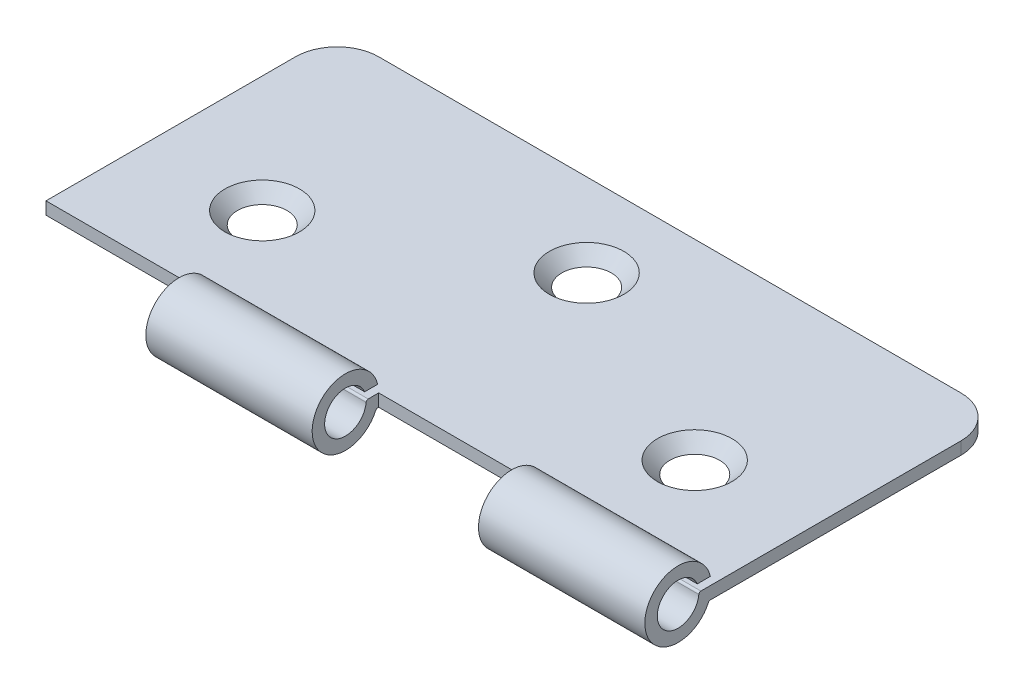
from build123d import *

# Parameters (mm, degrees)
BOSS_EXTRUDE1_DEPTH          = 1.5
BOSS_EXTRUDE2_DEPTH          = 20
LPATTERN1_COUNT              = 2
LPATTERN1_PITCH              = 40
CSK_FOR_M4_SFHCS1_AT_2_COUNT = 2
CSK_FOR_M4_SFHCS1_AT_2_PITCH = 29.068883707
CSK_FOR_M4_SFHCS1_AT_3_COUNT = 2
CSK_FOR_M4_SFHCS1_AT_3_PITCH = 52


with BuildPart() as part:
    # Sketch1 → Boss-Extrude1 (new body)
    with BuildSketch(Plane(origin=(0, 0, 0), x_dir=(1, 0, 0), z_dir=(0, 1, 0))):
        with BuildLine():
            Line((-40, -17.5), (40, -17.5))
            Line((40, -17.5), (40, 12.5))
            ThreePointArc((40, 12.5), (38.535533906, 16.035533906), (35, 17.5))
            Line((35, 17.5), (-35, 17.5))
            ThreePointArc((-35, 17.5), (-38.535533906, 16.035533906), (-40, 12.5))
            Line((-40, 12.5), (-40, -17.5))
        make_face()
    extrude(amount=BOSS_EXTRUDE1_DEPTH)

    # Sketch2 → Boss-Extrude2 (add)
    with BuildSketch(Plane(origin=(40, 0, 0), x_dir=(0, 0, -1), z_dir=(1, 0, 0))):
        with BuildLine():
            Line((-17.616081812, 2.45665015), (-19.190276967, 2.45665015))
            ThreePointArc((-19.190276967, 2.45665015), (-23.971620702, 1.124379043), (-19.010352011, 1.272727273))
            ThreePointArc((-19.010352011, 1.272727273), (-18.929937178, 1.434637236), (-18.761387212, 1.5))
            Line((-18.761387212, 1.5), (-17.5, 1.5))
            Line((-17.5, 1.5), (-17.5, 0))
            Line((-17.5, 0), (-17.627016654, 0))
            ThreePointArc((-17.627016654, 0), (-17.76259819, -0.039957987), (-17.854839204, -0.147058824))
            ThreePointArc((-17.854839204, -0.147058824), (-25.483287925, 1.865263339), (-17.616081812, 2.45665015))
        make_face()
    boss_extrude2 = extrude(amount=-BOSS_EXTRUDE2_DEPTH)

    # LPattern1: Boss-Extrude2 ×2
    with Locations(*[(-i * LPATTERN1_PITCH, 0, 0) for i in range(1, LPATTERN1_COUNT)]):
        add(boss_extrude2)

    # Sketch5 → CSK for M4 SFHCS1 (revolve, cut)
    with BuildSketch(Plane(origin=(-26, 1.5, 5.5), x_dir=(0, 0, 1), z_dir=(1, 0, 0))):
        Polygon((0, 0), (0, 4), (2.25, 4), (2.25, 2.23), (4.48, 0), align=None)
    csk_for_m4_sfhcs1 = revolve(axis=Axis((-26, 7.85, 5.5), (0, -1, 0)), mode=Mode.SUBTRACT)

    # CSK for M4 SFHCS1 at 2: CSK for M4 SFHCS1 ×2
    with Locations(*[Vector(0.894427190999916, 0, -0.44721359549995787) * (i * CSK_FOR_M4_SFHCS1_AT_2_PITCH) for i in range(1, CSK_FOR_M4_SFHCS1_AT_2_COUNT)]):
        add(csk_for_m4_sfhcs1, mode=Mode.SUBTRACT)

    # CSK for M4 SFHCS1 at 3: CSK for M4 SFHCS1 ×2
    with Locations(*[(i * CSK_FOR_M4_SFHCS1_AT_3_PITCH, 0, 0) for i in range(1, CSK_FOR_M4_SFHCS1_AT_3_COUNT)]):
        add(csk_for_m4_sfhcs1, mode=Mode.SUBTRACT)


solid = part.part
